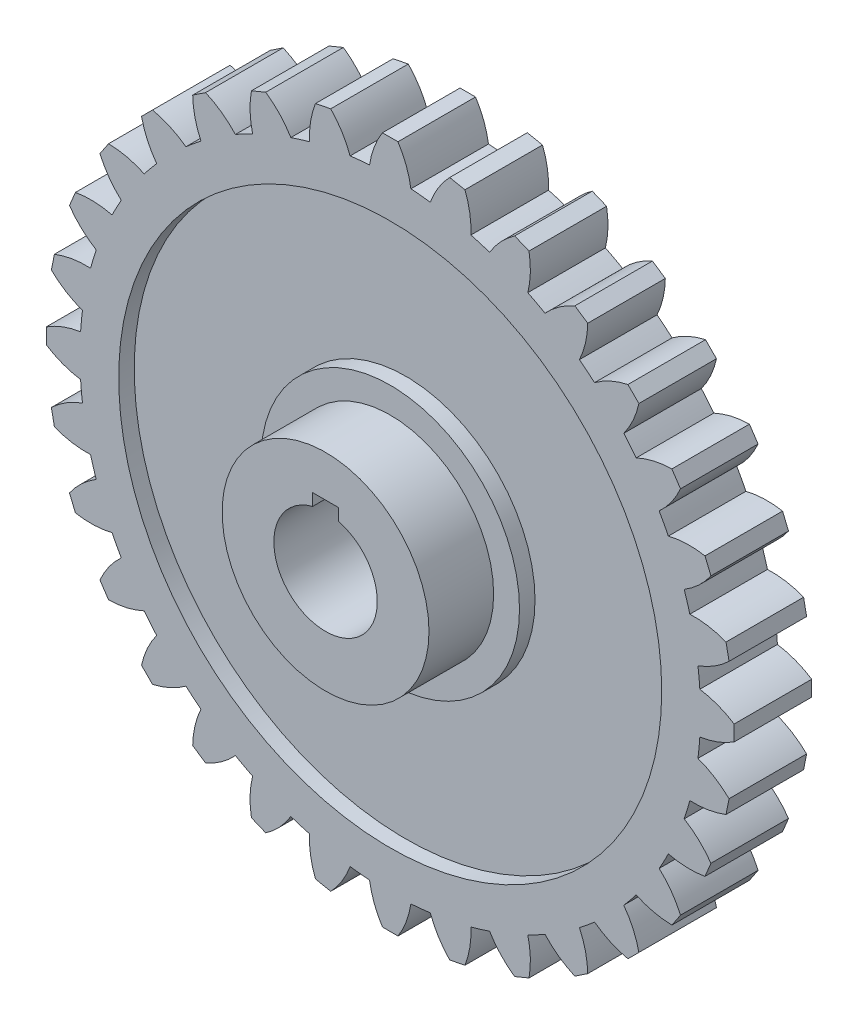
from build123d import *

# Parameters (mm, degrees)
SKETCH1_R               = 60
BOSS_EXTRUDE1_DEPTH     = 7.5
BOSS_EXTRUDE2_DEPTH     = 15
CIRPATTERN1_COUNT       = 32
SKETCH3_R               = 20
BOSS_EXTRUDE3_DEPTH     = 20
CUT_EXTRUDE1_DEPTH      = 103.198336581
CUT_EXTRUDE1_DEPTH_BACK = 103.198336581
CUT_EXTRUDE2_START      = 4.5
SKETCH5_R               = 52.5
SKETCH5_R_2             = 25
CUT_EXTRUDE2_DEPTH      = 100.148322918


with BuildPart() as part:
    # Sketch1 → Boss-Extrude1 (new, symmetric)
    with BuildSketch(Plane.XY):
        Circle(SKETCH1_R)
    extrude(amount=BOSS_EXTRUDE1_DEPTH, both=True)

    # Sketch2 → Boss-Extrude2 (add)
    with BuildSketch(Plane.XY.offset(7.5)):
        with BuildLine():
            Line((-1.5, 66.5), (1.5, 66.5))
            ThreePointArc((1.5, 66.5), (3.099609074, 63.315018359), (4, 59.866518188))
            ThreePointArc((4, 59.866518188), (0, 60), (-4, 59.866518188))
            ThreePointArc((-4, 59.866518188), (-3.099609074, 63.315018359), (-1.5, 66.5))
        make_face()
    boss_extrude2 = extrude(amount=-BOSS_EXTRUDE2_DEPTH)

    # CirPattern1: Boss-Extrude2 ×32 about axis
    cirpattern1_axis = Axis((0, 0, 0), (0, 0, 1))
    for i in range(1, CIRPATTERN1_COUNT):
        add(boss_extrude2.rotate(cirpattern1_axis, i * 360 / CIRPATTERN1_COUNT))

    # Sketch3 → Boss-Extrude3 (add, symmetric)
    with BuildSketch(Plane.XY):
        Circle(SKETCH3_R)
    extrude(amount=BOSS_EXTRUDE3_DEPTH, both=True)

    # Sketch4 → Cut-Extrude1 (cut, two sides: drawn at the far end of the back side and taken through both)
    with BuildSketch(Plane.XY.offset(20).offset(-CUT_EXTRUDE1_DEPTH_BACK)):
        with BuildLine():
            Line((-2.5, 12), (2.5, 12))
            Line((2.5, 12), (2.5, 9.682458366))
            ThreePointArc((2.5, 9.682458366), (0, -10), (-2.5, 9.682458366))
            Line((-2.5, 9.682458366), (-2.5, 12))
        make_face()
    extrude(amount=CUT_EXTRUDE1_DEPTH + CUT_EXTRUDE1_DEPTH_BACK, mode=Mode.SUBTRACT)

    # Sketch5 → Cut-Extrude2 (cut)
    with BuildSketch(Plane.XY.offset(CUT_EXTRUDE2_START)):
        Circle(SKETCH5_R)
        Circle(SKETCH5_R_2, mode=Mode.SUBTRACT)
    cut_extrude2 = extrude(amount=CUT_EXTRUDE2_DEPTH, mode=Mode.SUBTRACT)

    # Mirror1: Cut-Extrude2 across plane
    add(cut_extrude2.mirror(Plane.XY), mode=Mode.SUBTRACT)


solid = part.part
